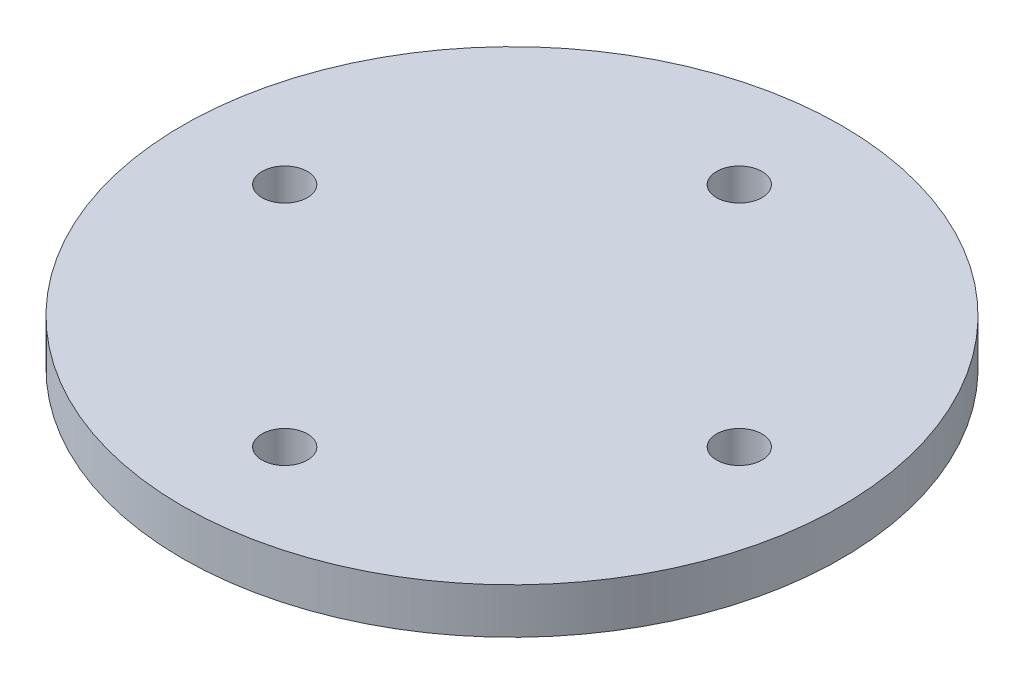
from build123d import *

# Parameters (mm, degrees)
SKETCH1_R                 = 14.5
BOSS_EXTRUDE1_DEPTH       = 2
F_2_0MM_DOWEL_HOLE1_D     = 2
F_2_0MM_DOWEL_HOLE1_DEPTH = 42.93
F_2_0MM_DOWEL_HOLE1_TIP   = 0.600860619


with BuildPart() as part:
    # Sketch1 → Boss-Extrude1 (new body)
    with BuildSketch(Plane(origin=(0, 0, 0), x_dir=(1, 0, 0), z_dir=(0, 1, 0))):
        with Locations(Location((0, 0, 0), (0, 0, 270))):
            Circle(SKETCH1_R)
    extrude(amount=BOSS_EXTRUDE1_DEPTH)

    # Ø2.0mm Dowel Hole1
    with Locations(Plane(origin=(0, 2, 0), x_dir=(1, 0, 0), z_dir=(0, 1, 0))):
        with Locations((-10, 0), (0, 10), (10, 0), (0, -10)):
            Hole(F_2_0MM_DOWEL_HOLE1_D / 2, depth=F_2_0MM_DOWEL_HOLE1_DEPTH)
            with Locations((0, 0, -(F_2_0MM_DOWEL_HOLE1_DEPTH + F_2_0MM_DOWEL_HOLE1_TIP / 2))):  # 118° drill point
                Cone(0, F_2_0MM_DOWEL_HOLE1_D / 2, F_2_0MM_DOWEL_HOLE1_TIP, mode=Mode.SUBTRACT)


solid = part.part
